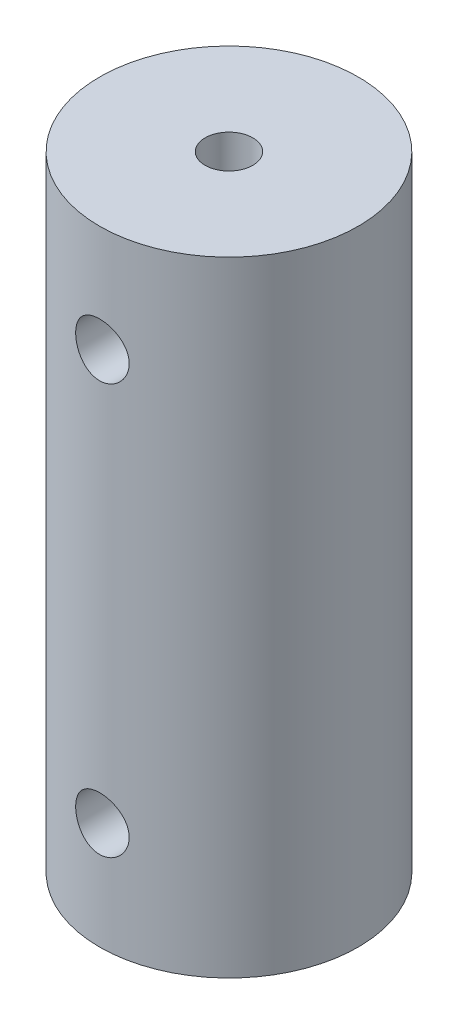
from build123d import *

# Parameters (mm, degrees)
CROQUIS2_R              = 14.5
SALIENTE_EXTRUIR1_DEPTH = 35
CROQUIS3_R              = 2.675
CORTAR_EXTRUIR1_DEPTH   = 14
CROQUIS7_R              = 3
CORTAR_EXTRUIR6_DEPTH   = 4.7
CORTAR_EXTRUIR8_START   = 9.8
CORTAR_EXTRUIR8_DEPTH   = 3
CORTAR_EXTRUIR2_REACH   = 42.565
CROQUIS4_R              = 1.75


with BuildPart() as part:
    # Croquis2 → Saliente-Extruir1 (new, symmetric)
    with BuildSketch(Plane(origin=(0, 0, 0), x_dir=(1, 0, 0), z_dir=(0, 1, 0))):
        with Locations(Location((0, 0, 0), (0, 0, 270))):
            Circle(CROQUIS2_R)
    extrude(amount=SALIENTE_EXTRUIR1_DEPTH, both=True)

    # Croquis3 → Cortar-Extruir1 (cut)
    with BuildSketch(Plane(origin=(0, 35, 0), x_dir=(1, 0, 0), z_dir=(0, 1, 0))):
        with Locations(Location((0, 0, 0), (0, 0, 270))):
            Circle(CROQUIS3_R)
    cortar_extruir1 = extrude(amount=-CORTAR_EXTRUIR1_DEPTH, mode=Mode.SUBTRACT)

    # Croquis7 → Cortar-Extruir6 (cut)
    with BuildSketch(Plane.XY.offset(14.5)):
        with Locations((0, 23)):
            Circle(CROQUIS7_R)
    cortar_extruir6 = extrude(amount=-CORTAR_EXTRUIR6_DEPTH, mode=Mode.SUBTRACT)

    # Croquis5 → Cortar-Extruir8 (cut)
    with BuildSketch(Plane.XY.offset(CORTAR_EXTRUIR8_START)):
        Polygon((-1.5, 20.401923789), (1.5, 20.401923789), (3, 23), (1.5, 25.598076211), (-1.5, 25.598076211), (-3, 23), align=None)
    cortar_extruir8 = extrude(amount=-CORTAR_EXTRUIR8_DEPTH, mode=Mode.SUBTRACT)

    # Croquis4 → Cortar-Extruir2 (cut, up to next)
    with BuildSketch(Plane.XY, mode=Mode.PRIVATE) as cortar_extruir2_sk1:
        with Locations(Location((0, 23, 0), (0, 0, 180))):
            Circle(CROQUIS4_R)
    cortar_extruir2_tool1 = extrude(cortar_extruir2_sk1.sketch, amount=CORTAR_EXTRUIR2_REACH, mode=Mode.PRIVATE) & part.part
    cortar_extruir2 = cortar_extruir2_tool1.solids().sort_by_distance((0, 23, 0))[0]
    add(cortar_extruir2, mode=Mode.SUBTRACT)

    # Simetría2: Cortar-Extruir1, Cortar-Extruir6, Cortar-Extruir8, Cortar-Extruir2 across plane
    add(cortar_extruir1.mirror(Plane.ZX), mode=Mode.SUBTRACT)
    add(cortar_extruir6.mirror(Plane.ZX), mode=Mode.SUBTRACT)
    add(cortar_extruir8.mirror(Plane.ZX), mode=Mode.SUBTRACT)
    add(cortar_extruir2.mirror(Plane.ZX), mode=Mode.SUBTRACT)


solid = part.part
